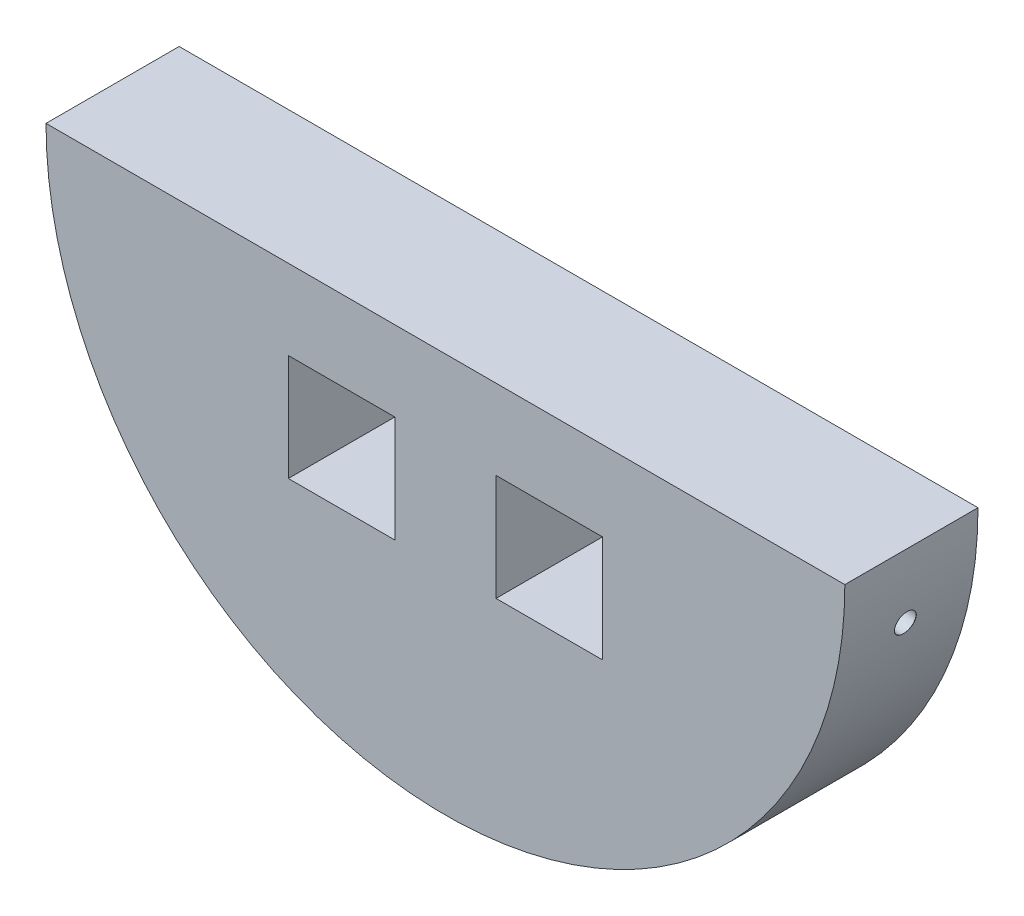
from build123d import *
from OCP.BRepFilletAPI import BRepFilletAPI_MakeChamfer

# Parameters (mm, degrees)
SKETCH1_W           = 20
SKETCH1_H           = 20
BOSS_EXTRUDE1_DEPTH = 25
CIRPATTERN1_COUNT   = 5
CIRPATTERN1_ANGLE   = 160
CHAMFER1_SIZE       = 15
CHAMFER1_SIZE2      = 8.660254038


with BuildPart() as part:
    # Sketch1 → Boss-Extrude1 (new body)
    with BuildSketch(Plane.XY):
        with BuildLine():
            Line((-150, 0), (0, 0))
            ThreePointArc((0, 0), (-75, -75), (-150, 0))
        make_face()
        with Locations((-55.5, -25)):
            Rectangle(SKETCH1_W, SKETCH1_H, mode=Mode.SUBTRACT)
        with Locations((-94.5, -25)):
            Rectangle(SKETCH1_W, SKETCH1_H, mode=Mode.SUBTRACT)
    extrude(amount=BOSS_EXTRUDE1_DEPTH)

    # Sketch4 → Ø4.0mm Dowel Hole2 (revolve, cut)
    with BuildSketch(Plane(origin=(-1.139418524, -13.023613325, 12.5), x_dir=(0.17364817766693047, 0.9848077530122081, 0), z_dir=(0, 0, 1))):
        Polygon((0, 0), (0, 17.201721238), (2, 16), (2, 0.025), (2.025, 0), align=None)
    f_4_0mm_dowel_hole2 = revolve(axis=Axis((5.114110708, -14.126279253, 12.5), (-0.9848077530122081, 0.17364817766693044, 0)), mode=Mode.SUBTRACT)

    # CirPattern1: Ø4.0mm Dowel Hole2 ×5 about axis
    cirpattern1_axis = Axis((-75, 0, 0), (0, 0, -1))
    for i in range(1, CIRPATTERN1_COUNT):
        add(f_4_0mm_dowel_hole2.rotate(cirpattern1_axis, i * CIRPATTERN1_ANGLE / (CIRPATTERN1_COUNT - 1)), mode=Mode.SUBTRACT)

    # Chamfer1: one chamfer whose edges measure the first distance from different faces: ONE call of the kernel's chamfer builder (chamfer() names one face for all edges)
    chamfer1_edges_1 = [part.edges().sort_by_distance(p)[0] for p in [
        (-55.5, -15, 0),
    ]]
    chamfer1_side_1 = [part.faces().sort_by_distance(p)[0] for p in [
        (-55.5, -15, 12.5),
    ]]
    chamfer1_edges_2 = [part.edges().sort_by_distance(p)[0] for p in [
        (-94.5, -15, 0),
    ]]
    chamfer1_side_2 = [part.faces().sort_by_distance(p)[0] for p in [
        (-94.5, -15, 12.5),
    ]]
    chamfer1 = BRepFilletAPI_MakeChamfer(part.part.solid().wrapped)
    for e in chamfer1_edges_1:
        chamfer1.Add(CHAMFER1_SIZE, CHAMFER1_SIZE2, e.wrapped, chamfer1_side_1[0].wrapped)  # the first distance lies on this face
    for e in chamfer1_edges_2:
        chamfer1.Add(CHAMFER1_SIZE, CHAMFER1_SIZE2, e.wrapped, chamfer1_side_2[0].wrapped)  # the first distance lies on this face
    add(Compound.cast(chamfer1.Shape()), mode=Mode.REPLACE)


solid = part.part
